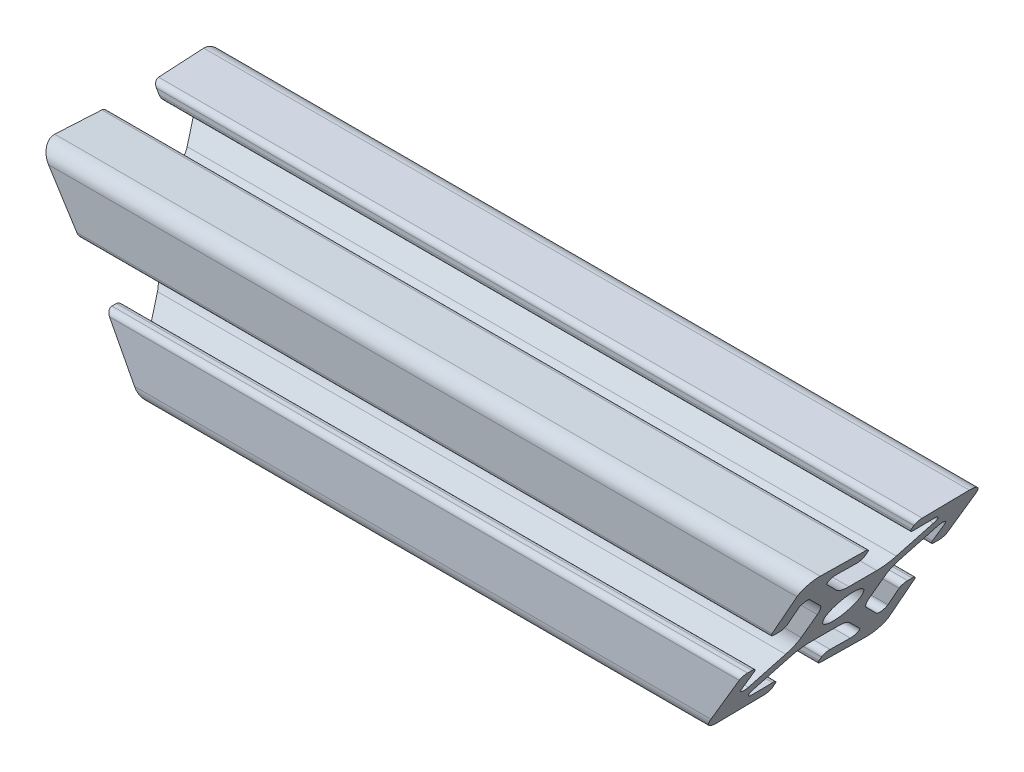
from build123d import *

# Parameters (mm, degrees)
BOSS_EXTRUDE1_DEPTH      = 54.447276
BOSS_EXTRUDE1_DEPTH_BACK = 54.447276
CUT_EXTRUDE1_DEPTH       = 12.7
CUT_EXTRUDE1_DEPTH_BACK  = 12.7


with BuildPart() as part:
    # Sketch3 → Boss-Extrude1 (new, two sides: drawn at the far end of the back side and taken through both)
    with BuildSketch(Plane(origin=(0, 0, 0), x_dir=(0, 0, -1), z_dir=(1, 0, 0)).offset(-BOSS_EXTRUDE1_DEPTH_BACK)):
        with BuildLine():
            Line((0, 4.826), (1.984228399, 4.826))
            ThreePointArc((1.984228399, 4.826), (3.199248297, 5.067682484), (4.229292429, 5.75593597))
            Line((4.229292429, 5.75593597), (7.586577723, 9.113221264))
            ThreePointArc((7.586577723, 9.113221264), (7.746562132, 9.955883421), (7.021168939, 10.413572441))
            Line((7.021168939, 10.413572441), (4.090593416, 10.311234489))
            ThreePointArc((4.090593416, 10.311234489), (3.534670322, 10.524633371), (3.302, 11.072770299))
            Line((3.302, 11.072770299), (3.302, 11.70815736))
            ThreePointArc((3.302, 11.70815736), (3.515863072, 12.237487038), (4.037406584, 12.46969317))
            Line((4.037406584, 12.46969317), (10.597084223, 12.698762161))
            ThreePointArc((10.597084223, 12.698762161), (12.104840979, 12.104840979), (12.698762161, 10.597084223))
            Line((12.698762161, 10.597084223), (12.46969317, 4.037406584))
            ThreePointArc((12.46969317, 4.037406584), (12.237487038, 3.515863072), (11.70815736, 3.302))
            Line((11.70815736, 3.302), (11.072770299, 3.302))
            ThreePointArc((11.072770299, 3.302), (10.524633371, 3.534670322), (10.311234489, 4.090593416))
            Line((10.311234489, 4.090593416), (10.413572441, 7.021168939))
            ThreePointArc((10.413572441, 7.021168939), (9.955883421, 7.746562132), (9.113221264, 7.586577723))
            Line((9.113221264, 7.586577723), (5.75593597, 4.229292429))
            ThreePointArc((5.75593597, 4.229292429), (5.067682484, 3.199248297), (4.826, 1.984228399))
            Line((4.826, 1.984228399), (4.826, 0))
            Line((4.826, 0), (2.54, 0))
            ThreePointArc((2.54, 0), (1.796051224, 1.796051224), (0, 2.54))
            Line((0, 2.54), (0, 4.826))
        make_face()
    extrude(amount=BOSS_EXTRUDE1_DEPTH + BOSS_EXTRUDE1_DEPTH_BACK)

    # Mirror1: part across plane


with BuildPart() as part_1:
    add(part.part)
    add(part.part.mirror(Plane.ZX))

    # Mirror2: part across plane


with BuildPart() as part_2:
    add(part_1.part)
    add(part_1.part.mirror(Plane.XY))

    # Sketch4 → Cut-Extrude1 (cut, two sides: drawn at the far end of the back side and taken through both)
    with BuildSketch(Plane.XY.offset(-CUT_EXTRUDE1_DEPTH_BACK)):
        Polygon((-56.987275902, -38.1), (56.987275902, -38.1), (56.987275902, 12.7), (54.447275902, 12.7), (39.782579065, -12.7), (-39.782579065, -12.7), (-54.447275902, 12.7), (-56.987275902, 12.7), align=None)
    extrude(amount=CUT_EXTRUDE1_DEPTH + CUT_EXTRUDE1_DEPTH_BACK, mode=Mode.SUBTRACT)


solid = part_2.part
